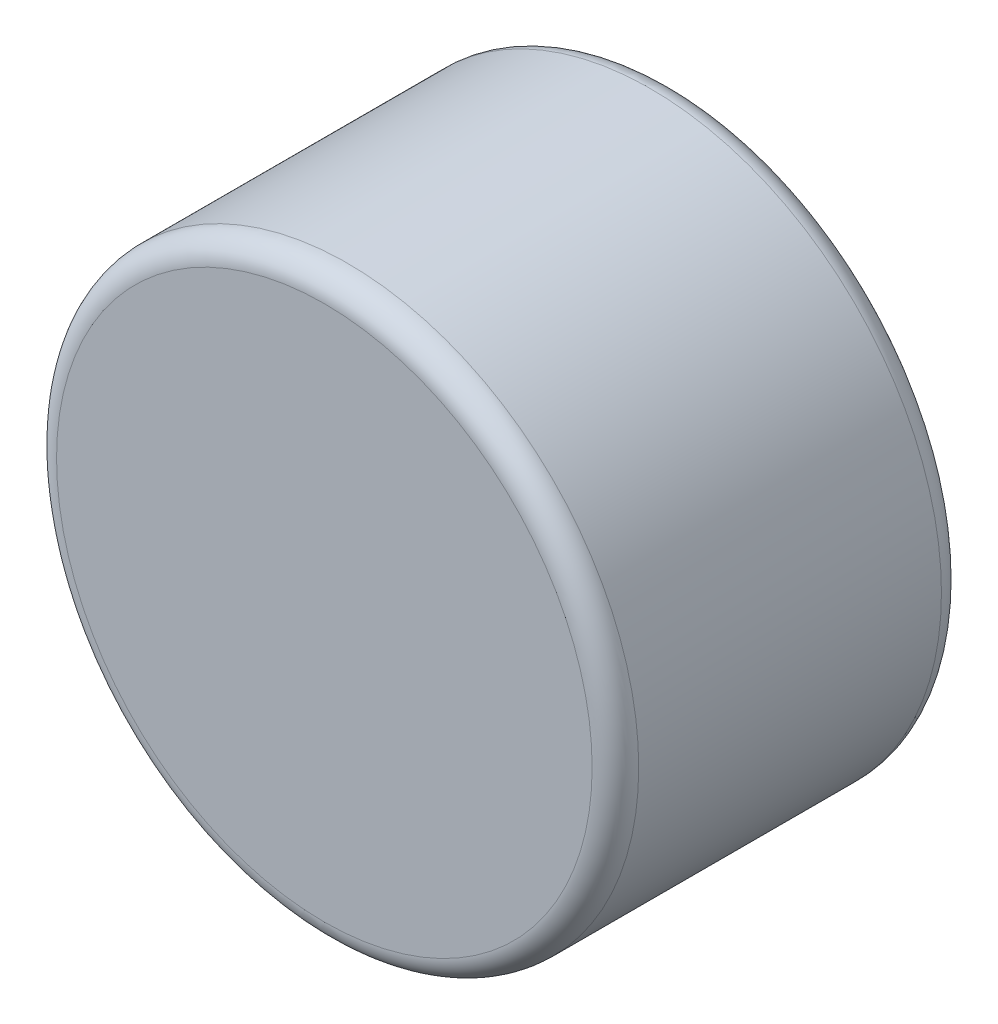
from build123d import *

# Parameters (mm, degrees)
SKETCH_1_R      = 2.5
EXTRUDE_1_DEPTH = 3
FILLET_1_R      = 0.2


with BuildPart() as part:
    # 草图1 → 凸台-拉伸1 (new body)
    with BuildSketch(Plane.XY):
        Circle(SKETCH_1_R)
    extrude(amount=EXTRUDE_1_DEPTH)

    # 圆角1
    fillet_1_edges = [part.edges().sort_by_distance(p)[0] for p in [
        (-2.5, 0, 0),
        (-2.5, 0, 3),
    ]]
    fillet(fillet_1_edges, radius=FILLET_1_R)


solid = part.part
